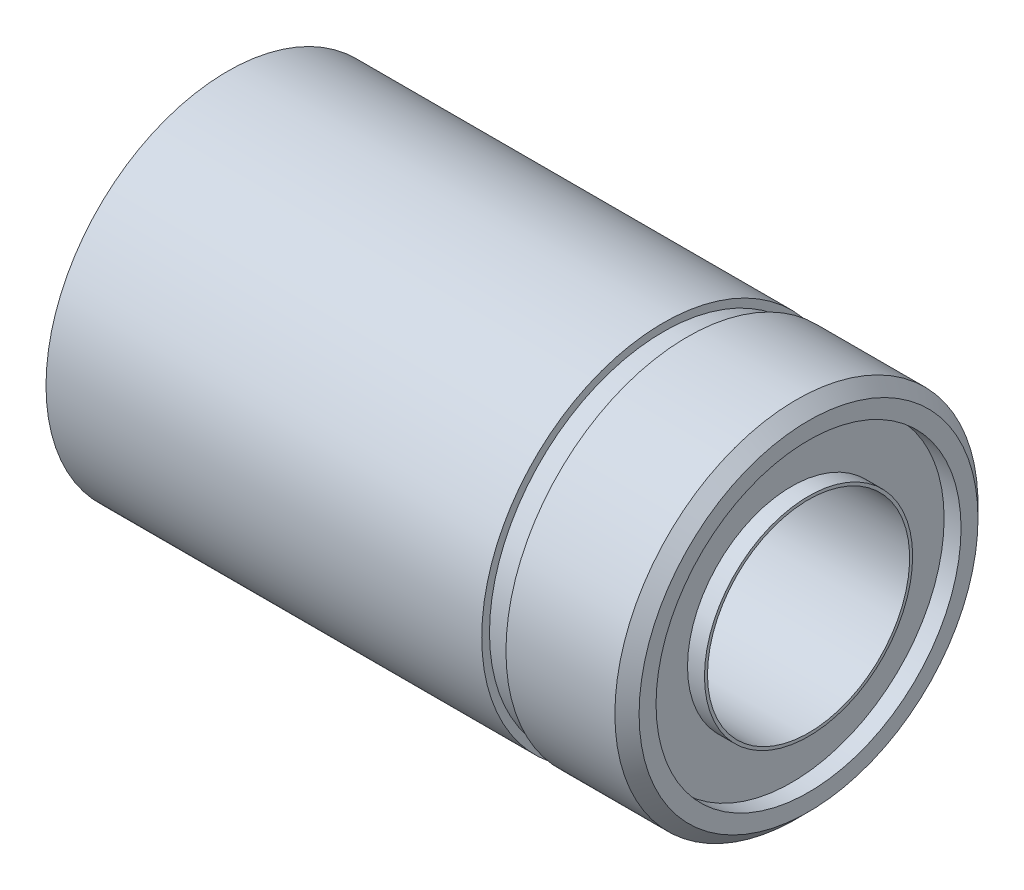
from build123d import *

# Parameters (mm, degrees)
ZKOSEN_1_SIZE       = 0.5
SKETCH_1_R          = 8.79999935
CUT_EXTRUDE_1_DEPTH = 21


with BuildPart() as part:
    # Skica1 → Rotovat1 (revolve)
    with BuildSketch(Plane.XY, mode=Mode.PRIVATE) as rotovat1_sk:
        Polygon((0, 4.3), (0, 4.175), (45, 4.175), (45, 4.3), (44.3, 4.3), (44.3, 6.3), (45, 6.3), (45, 7.5), (40, 7.5), (40, 7.18), (39, 7.18), (39, 7.5), (6, 7.5), (6, 7.18), (5, 7.18), (5, 7.5), (0, 7.5), (0, 6.3), (0.7, 6.3), (0.7, 4.3), align=None)
    revolve(rotovat1_sk.sketch.rotate(Axis((0, 0, 0), (1, 0, 0)), 90), axis=Axis((0, 0, 0), (1, 0, 0)))

    # Zkosení1
    zkosen_1_edges = [part.edges().sort_by_distance(p)[0] for p in [
        (0, 0, -7.5),
        (45, 0, -7.5),
    ]]
    chamfer(zkosen_1_edges, length=ZKOSEN_1_SIZE)

    # 草图1 → 切除-拉伸1 (cut)
    with BuildSketch(Plane.ZY):
        Circle(SKETCH_1_R)
    extrude(amount=-CUT_EXTRUDE_1_DEPTH, mode=Mode.SUBTRACT)


solid = part.part
